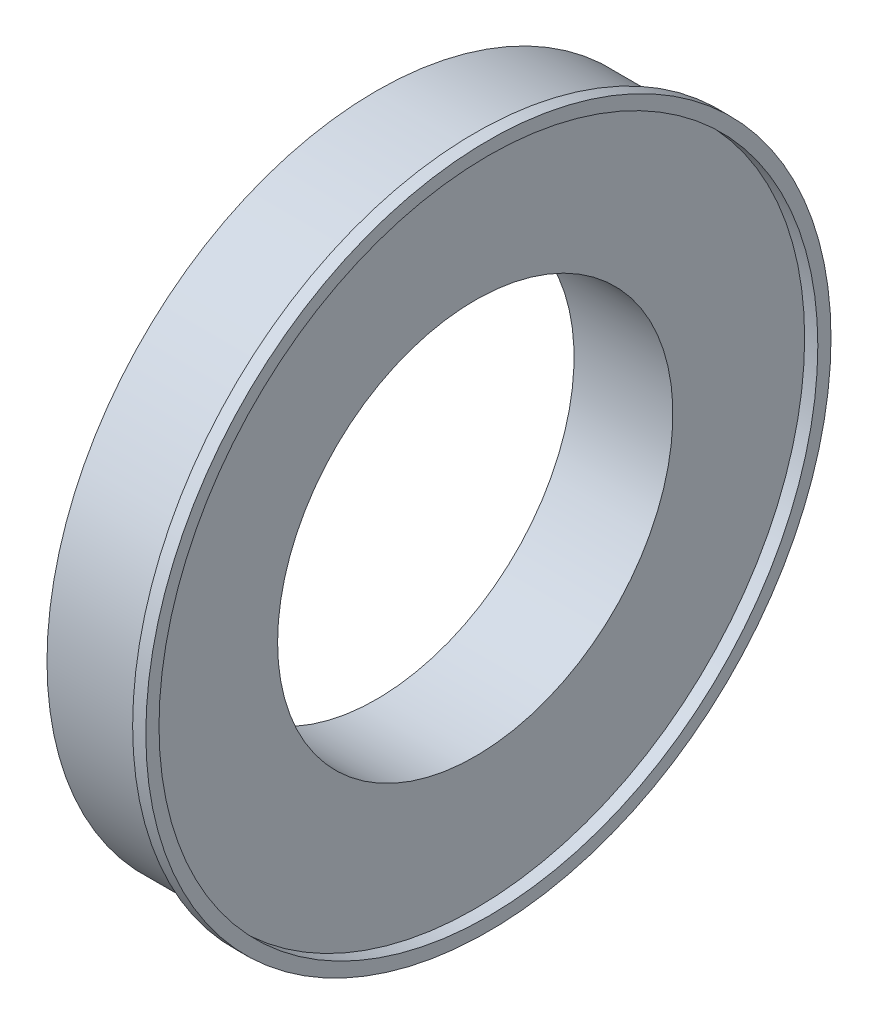
from build123d import *

# Parameters (mm, degrees)
SKETCH1_R           = 63.5
SKETCH1_R_2         = 38.1
BOSS_EXTRUDE1_DEPTH = 19.05
SKETCH2_R           = 66.04
SKETCH2_R_2         = 63.5
BOSS_EXTRUDE2_DEPTH = 2.54


with BuildPart() as part:
    # Sketch1 → Boss-Extrude1 (new body)
    with BuildSketch(Plane(origin=(0, 0, 0), x_dir=(0, 0, -1), z_dir=(1, 0, 0))):
        with Locations(Location((0, 0, 0), (0, 0, 180))):
            Circle(SKETCH1_R)
        with Locations(Location((0, 0, 0), (0, 0, 180))):
            Circle(SKETCH1_R_2, mode=Mode.SUBTRACT)
    extrude(amount=BOSS_EXTRUDE1_DEPTH)


with BuildPart() as body_2:
    # Sketch2 → Boss-Extrude2 (new body)
    with BuildSketch(Plane(origin=(19.05, 0, 0), x_dir=(0, 0, -1), z_dir=(1, 0, 0))):
        Circle(SKETCH2_R)
        Circle(SKETCH2_R_2, mode=Mode.SUBTRACT)
    extrude(amount=BOSS_EXTRUDE2_DEPTH)


solid = Compound([part.part, body_2.part])
